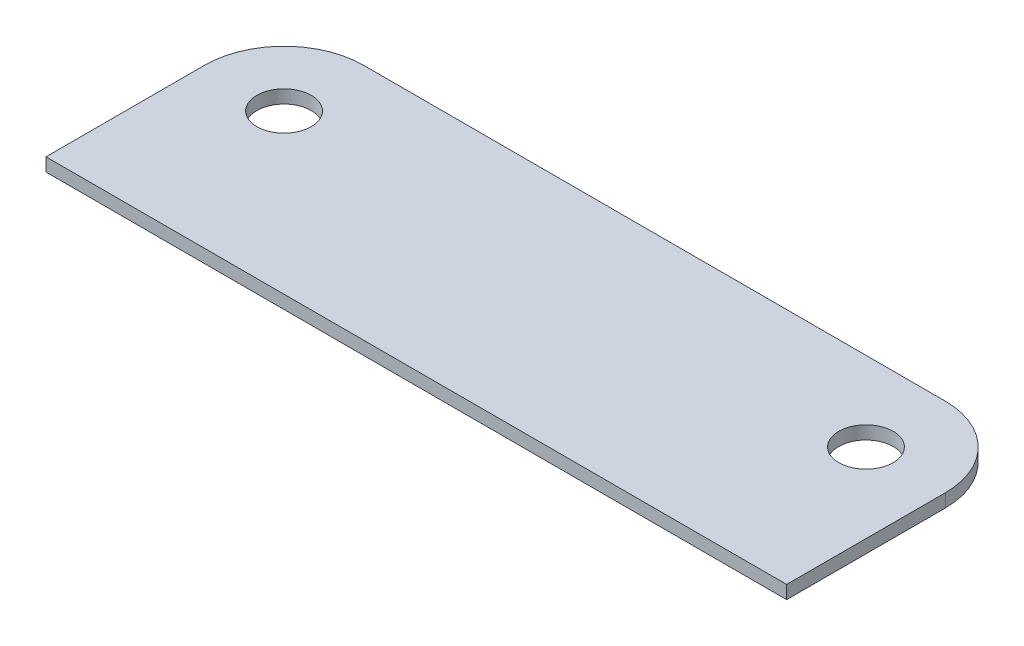
from build123d import *

# Parameters (mm, degrees)
SKETCH1_R           = 3.2639
BOSS_EXTRUDE1_DEPTH = 1.5875


with BuildPart() as part:
    # Sketch1 → Boss-Extrude1 (new body)
    with BuildSketch(Plane(origin=(0, 0, 0), x_dir=(1, 0, 0), z_dir=(0, 1, 0))):
        with BuildLine():
            Line((-44.45, 0), (44.45, 0))
            Line((44.45, 0), (44.45, 19.05))
            ThreePointArc((44.45, 19.05), (41.660192091, 25.785192091), (34.925, 28.575))
            Line((34.925, 28.575), (-34.925, 28.575))
            ThreePointArc((-34.925, 28.575), (-41.660192091, 25.785192091), (-44.45, 19.05))
            Line((-44.45, 19.05), (-44.45, 0))
        make_face()
        with Locations(Location((-34.925, 19.05, 0), (0, 0, 270))):
            Circle(SKETCH1_R, mode=Mode.SUBTRACT)
        with Locations(Location((34.925, 19.05, 0), (0, 0, 270))):
            Circle(SKETCH1_R, mode=Mode.SUBTRACT)
    extrude(amount=BOSS_EXTRUDE1_DEPTH)


solid = part.part
